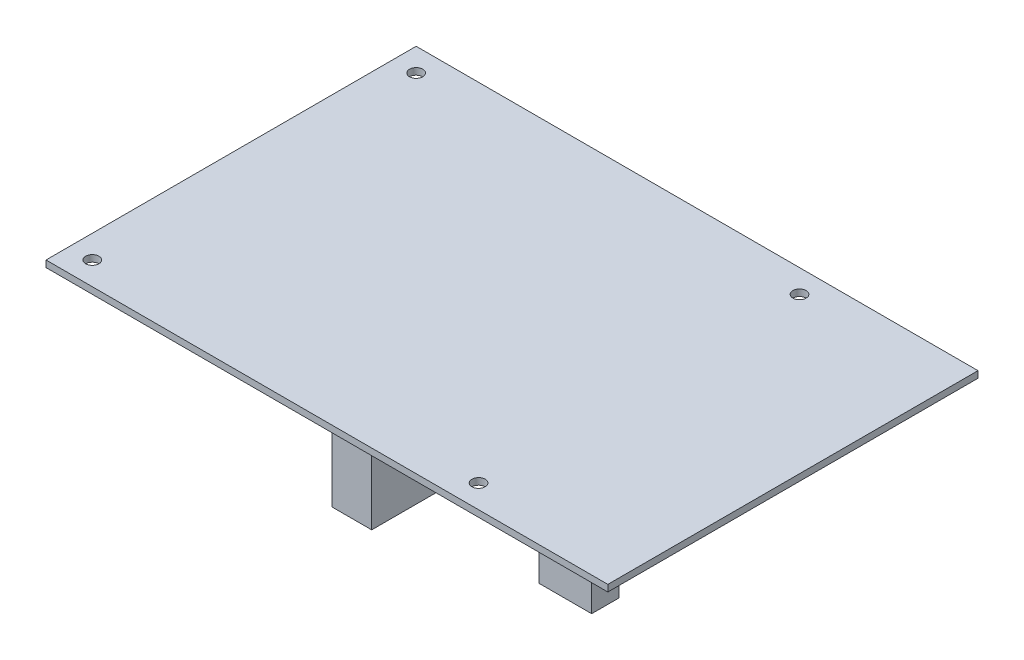
from build123d import *

# Parameters (mm, degrees)
ESQUISSE1_W             = 85
ESQUISSE1_H             = 56
ESQUISSE1_R             = 1
BOSS_EXTRU_1_DEPTH      = 1
ESQUISSE2_W             = 6
ESQUISSE2_H             = 15.454409224
ESQUISSE2_W_2           = 8
ESQUISSE2_H_2           = 4.146304914
BOSS_EXTRU_2_DEPTH      = 30
CONG_1_R                = 5
ESQUISSE3_R             = 0.85
ENL_V_MAT_EXTRU_1_DEPTH = 5


with BuildPart() as part:
    # Esquisse1 → Boss.-Extru.1 (new body)
    with BuildSketch(Plane(origin=(0, 0, 0), x_dir=(1, 0, 0), z_dir=(0, 1, 0))):
        with Locations((9.925986842, -10.804276316)):
            Rectangle(ESQUISSE1_W, ESQUISSE1_H)
        with Locations(Location((-29.074013158, 13.695723684, 0), (0, 0, 270))):
            Circle(ESQUISSE1_R, mode=Mode.SUBTRACT)
        with Locations(Location((28.925986842, 13.695723684, 0), (0, 0, 270))):
            Circle(ESQUISSE1_R, mode=Mode.SUBTRACT)
        with Locations(Location((29.363486842, -35.304276316, 0), (0, 0, 270))):
            Circle(ESQUISSE1_R, mode=Mode.SUBTRACT)
        with Locations(Location((-29.074013158, -35.304276316, 0), (0, 0, 270))):
            Circle(ESQUISSE1_R, mode=Mode.SUBTRACT)
    extrude(amount=BOSS_EXTRU_1_DEPTH)

    # Esquisse2 → Boss.-Extru.2 (add)
    with BuildSketch(Plane.XZ):
        with Locations((-6.574013158, 10.804276316)):
            Rectangle(ESQUISSE2_W, ESQUISSE2_H)
        with Locations((20.05121001, 10.804276316)):
            Rectangle(ESQUISSE2_W_2, ESQUISSE2_H_2)
    extrude(amount=BOSS_EXTRU_2_DEPTH)

    # Congé1
    cong_1_edges = [part.edges().sort_by_distance(p)[0] for p in [
        (-9.574013158, 0, 10.804276316),
        (-6.574013158, 0, 3.077071704),
        (-3.574013158, 0, 10.804276316),
        (-6.574013158, 0, 18.531480928),
        (16.05121001, 0, 10.804276316),
        (20.05121001, 0, 8.731123859),
        (24.05121001, 0, 10.804276316),
        (20.05121001, 0, 12.877428773),
    ]]
    fillet(cong_1_edges, radius=CONG_1_R)

    # Esquisse3 → Enlèv. mat.-Extru.1 (cut)
    with BuildSketch(Plane.XZ.offset(30)):
        with Locations(Location((-6.574013158, 14.304276316, 0), (0, 0, 270))):
            Circle(ESQUISSE3_R)
        with Locations(Location((-6.574013158, 7.304276316, 0), (0, 0, 270))):
            Circle(ESQUISSE3_R)
    extrude(amount=-ENL_V_MAT_EXTRU_1_DEPTH, mode=Mode.SUBTRACT)


solid = part.part
